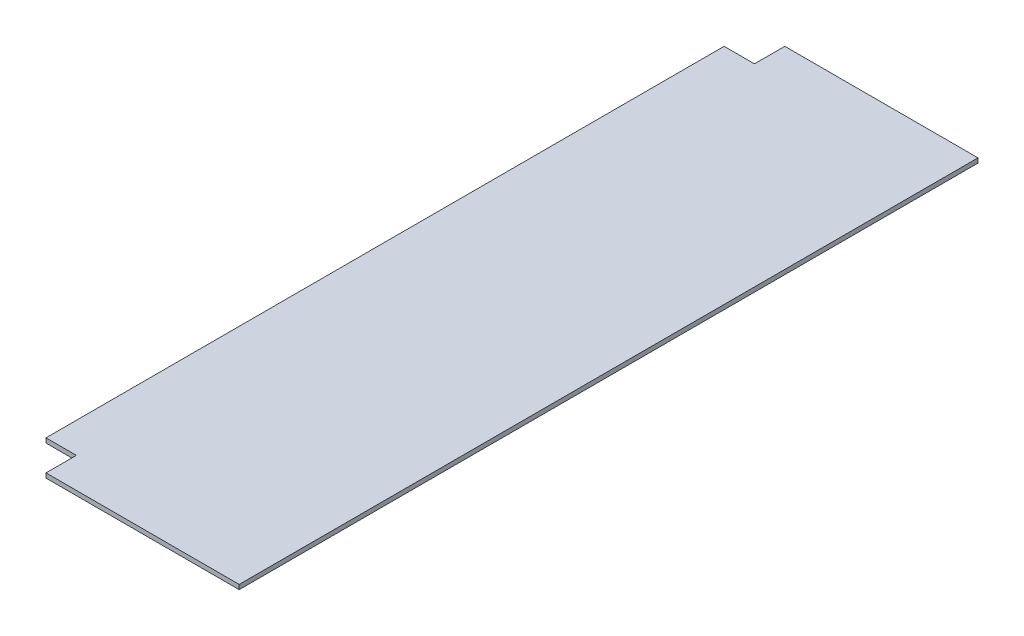
from build123d import *

# Parameters (mm, degrees)
BOSS_EXTRUDE1_DEPTH = 4.5


with BuildPart() as part:
    # Sketch1 → Boss-Extrude1 (new body)
    with BuildSketch(Plane(origin=(0, 0, 0), x_dir=(1, 0, 0), z_dir=(0, 1, 0))):
        Polygon((-66.962544804, 365), (123.917455196, 365), (123.917455196, -365), (-66.962544804, -365), (-66.962544804, -335), (-96.962544804, -335), (-96.962544804, 335), (-66.962544804, 335), align=None)
    extrude(amount=BOSS_EXTRUDE1_DEPTH)


solid = part.part
